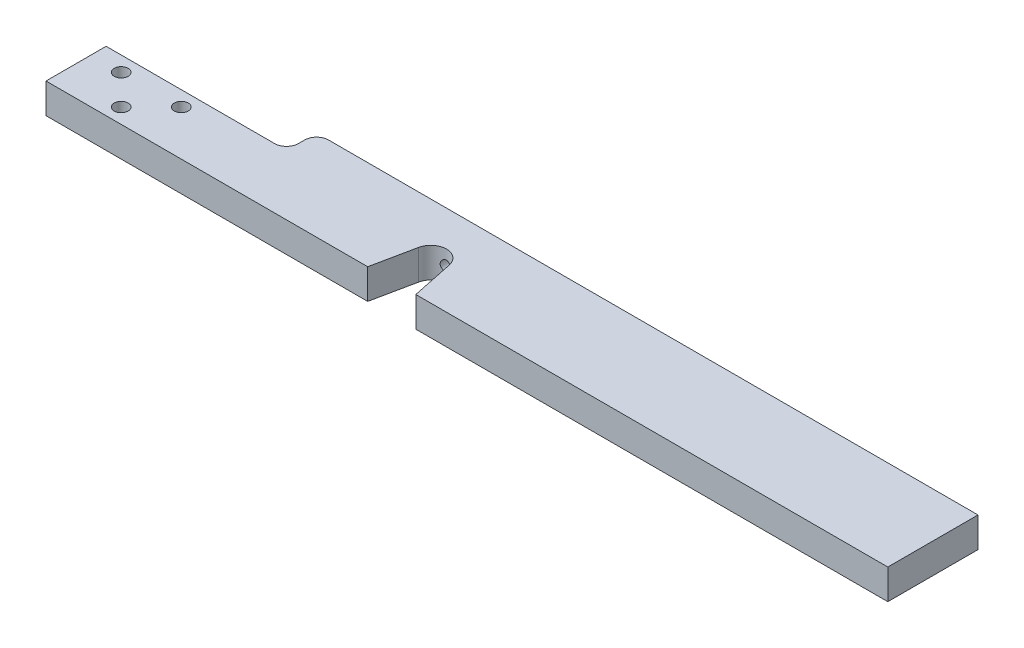
from build123d import *

# Parameters (mm, degrees)
BOSS_EXTRUDE1_DEPTH             = 6.35
F_32_0_116_DIAMETER_HOLE1_D     = 2.9464
F_32_0_116_DIAMETER_HOLE1_DEPTH = 7.62
F_32_0_116_DIAMETER_HOLE1_TIP   = 0.885187864
F_4_40_TAPPED_HOLE1_D           = 2.2606


with BuildPart() as part:
    # Sketch1 → Boss-Extrude1 (new body)
    with BuildSketch(Plane(origin=(0, 0, 0), x_dir=(1, 0, 0), z_dir=(0, 1, 0))):
        with BuildLine():
            Line((0, 0), (67.945, 0))
            Line((67.945, 0), (69.791491908, 8.924051134))
            ThreePointArc((69.791491908, 8.924051134), (73.025, 11.557), (76.258508092, 8.924051134))
            Line((76.258508092, 8.924051134), (78.105, 0))
            Line((78.105, 0), (177.8, 0))
            Line((177.8, 0), (177.8, 19.05))
            Line((177.8, 19.05), (40.64, 19.05))
            ThreePointArc((40.64, 19.05), (38.843948776, 18.306051224), (38.1, 16.51))
            Line((38.1, 16.51), (38.1, 15.24))
            ThreePointArc((38.1, 15.24), (37.356051224, 13.443948776), (35.56, 12.7))
            Line((35.56, 12.7), (0, 12.7))
            Line((0, 12.7), (0, 0))
        make_face()
    extrude(amount=BOSS_EXTRUDE1_DEPTH)

    # #32 (0.116) Diameter Hole1
    with Locations(Plane(origin=(6.35, 6.35, -9.525), x_dir=(0, 0, 1), z_dir=(0, 1, 0))):
        with Locations((0, 0), (0, 12.7), (6.35, 6.35)):
            Hole(F_32_0_116_DIAMETER_HOLE1_D / 2, depth=F_32_0_116_DIAMETER_HOLE1_DEPTH)
            with Locations((0, 0, -(F_32_0_116_DIAMETER_HOLE1_DEPTH + F_32_0_116_DIAMETER_HOLE1_TIP / 2))):  # 118° drill point
                Cone(0, F_32_0_116_DIAMETER_HOLE1_D / 2, F_32_0_116_DIAMETER_HOLE1_TIP, mode=Mode.SUBTRACT)

    # #4-40 Tapped Hole1 (through all)
    with Locations(Plane(origin=(0, 0, -19.05), x_dir=(-1, 0, 0), z_dir=(0, 0, -1))):
        with Locations((-73.025, 3.175)):
            Hole(F_4_40_TAPPED_HOLE1_D / 2)


solid = part.part
